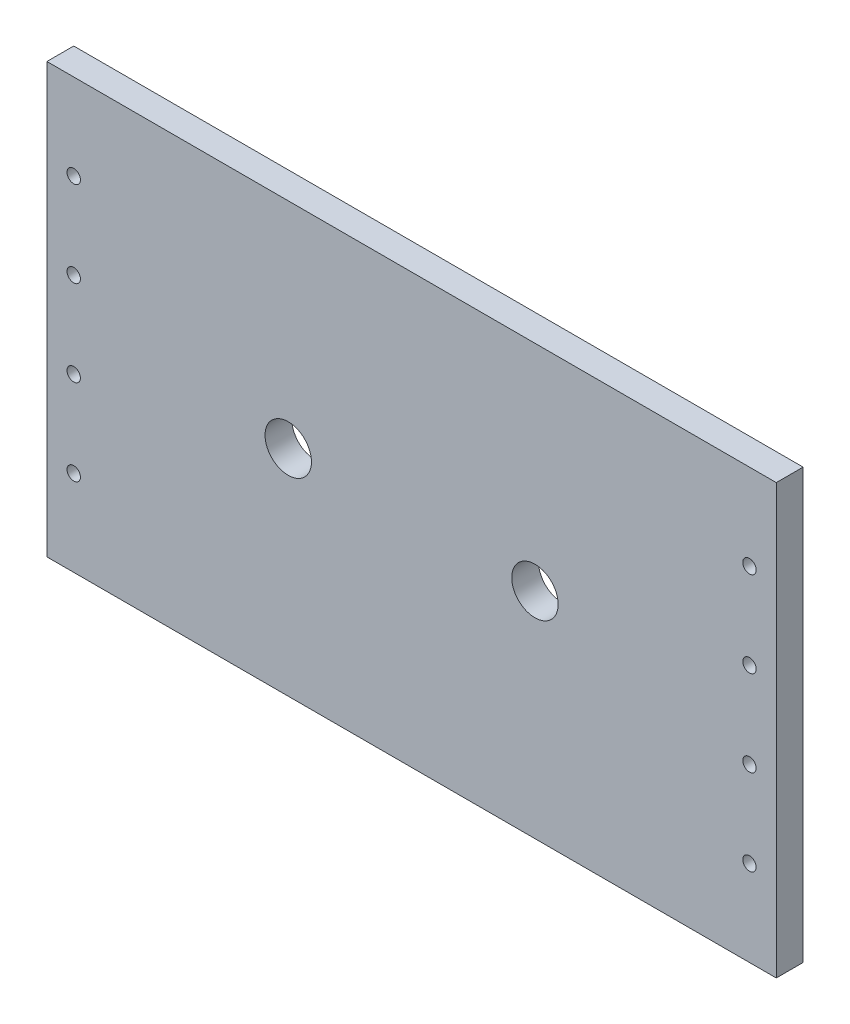
from build123d import *

# Parameters (mm, degrees)
SKETCH1_W           = 172.72
SKETCH1_H           = 101.6
BOSS_EXTRUDE1_DEPTH = 6.35
SKETCH2_R           = 1.5875
CUT_EXTRUDE1_DEPTH  = 6.35
SKETCH5_R           = 5.499261314
CUT_EXTRUDE3_DEPTH  = 6.35


with BuildPart() as part:
    # Sketch1 → Boss-Extrude1 (new body)
    with BuildSketch(Plane.XY):
        with Locations((86.36, 50.8)):
            Rectangle(SKETCH1_W, SKETCH1_H)
    extrude(amount=BOSS_EXTRUDE1_DEPTH)

    # Sketch2 → Cut-Extrude1 (cut)
    with BuildSketch(Plane.XY.offset(6.35)):
        with Locations((6.35, 81.28)):
            Circle(SKETCH2_R)
        with Locations((6.35, 60.96)):
            Circle(SKETCH2_R)
        with Locations((6.35, 40.64)):
            Circle(SKETCH2_R)
        with Locations((6.35, 20.32)):
            Circle(SKETCH2_R)
        with Locations((166.37, 20.32)):
            Circle(SKETCH2_R)
        with Locations((166.37, 40.64)):
            Circle(SKETCH2_R)
        with Locations((166.37, 60.96)):
            Circle(SKETCH2_R)
        with Locations((166.37, 81.28)):
            Circle(SKETCH2_R)
    extrude(amount=-CUT_EXTRUDE1_DEPTH, mode=Mode.SUBTRACT)

    # Sketch5 → Cut-Extrude3 (cut)
    with BuildSketch(Plane.XY.offset(6.35)):
        with Locations((115.57, 50.8)):
            Circle(SKETCH5_R)
        with Locations((57.15, 50.8)):
            Circle(SKETCH5_R)
    extrude(amount=-CUT_EXTRUDE3_DEPTH, mode=Mode.SUBTRACT)


solid = part.part
